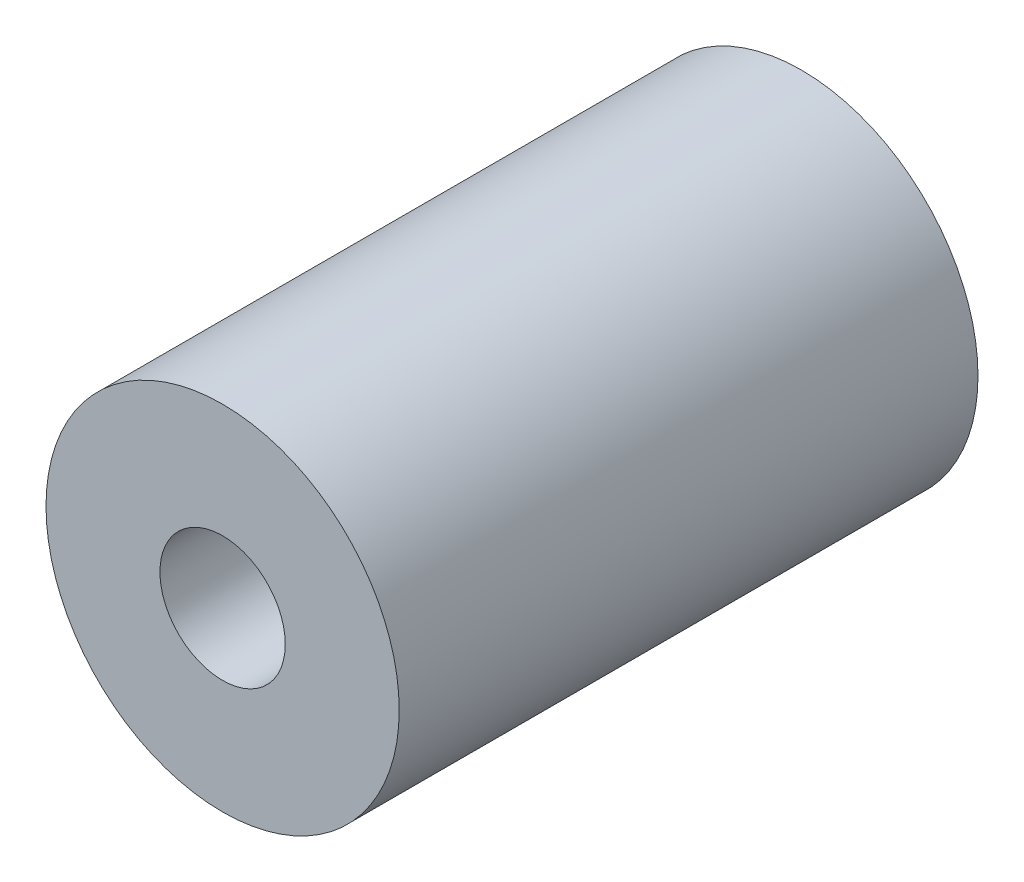
from build123d import *

# Parameters (mm, degrees)
SKETCH1_R           = 7.75
SKETCH1_R_2         = 2.75
BOSS_EXTRUDE1_DEPTH = 12.7


with BuildPart() as part:
    # Sketch1 → Boss-Extrude1 (new, symmetric)
    with BuildSketch(Plane.XY):
        Circle(SKETCH1_R)
        Circle(SKETCH1_R_2, mode=Mode.SUBTRACT)
    extrude(amount=BOSS_EXTRUDE1_DEPTH, both=True)


solid = part.part
